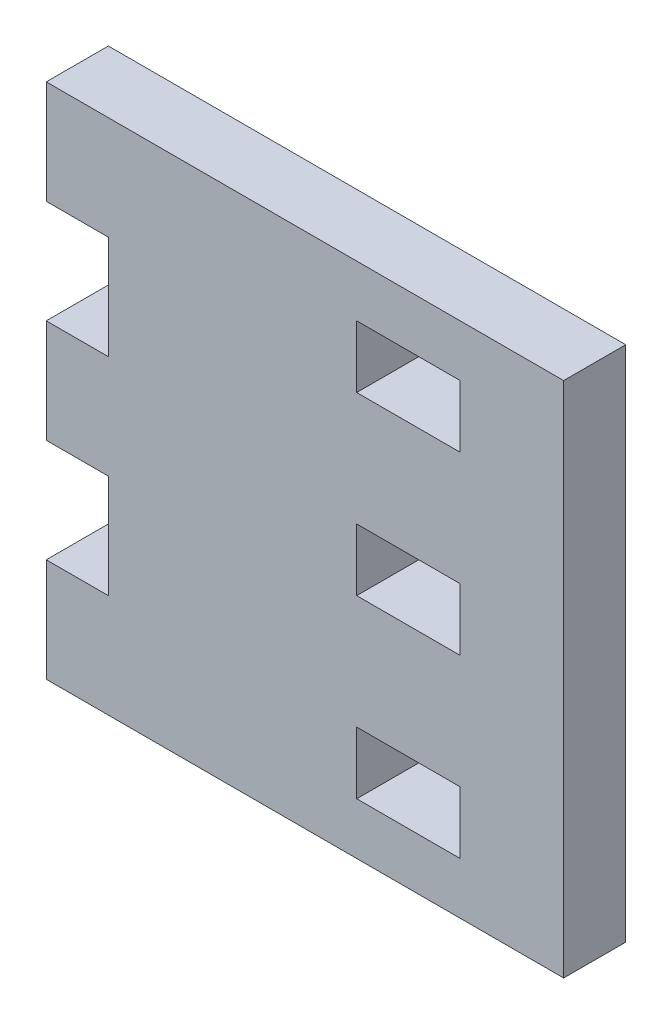
from build123d import *

# Parameters (mm, degrees)
SKETCH_1_W      = 10
SKETCH_1_H      = 6
EXTRUDE_1_DEPTH = 6


with BuildPart() as part:
    # 草圖1 → 填料-伸長1 (new body)
    with BuildSketch(Plane.XY):
        Polygon((-26.362898543, 32.763671875), (23.637101457, 32.763671875), (23.637101457, -17.236328125), (-26.362898543, -17.236328125), (-26.362898543, -7.236328125), (-20.362898543, -7.236328125), (-20.362898543, 2.763671875), (-26.362898543, 2.763671875), (-26.362898543, 12.763671875), (-20.362898543, 12.763671875), (-20.362898543, 22.763671875), (-26.362898543, 22.763671875), align=None)
        with Locations((8.637101457, 7.763671875)):
            Rectangle(SKETCH_1_W, SKETCH_1_H, mode=Mode.SUBTRACT)
        with Locations((8.637101457, 24.763671875)):
            Rectangle(SKETCH_1_W, SKETCH_1_H, mode=Mode.SUBTRACT)
        with Locations((8.637101457, -9.236328125)):
            Rectangle(SKETCH_1_W, SKETCH_1_H, mode=Mode.SUBTRACT)
    extrude(amount=EXTRUDE_1_DEPTH)


solid = part.part
